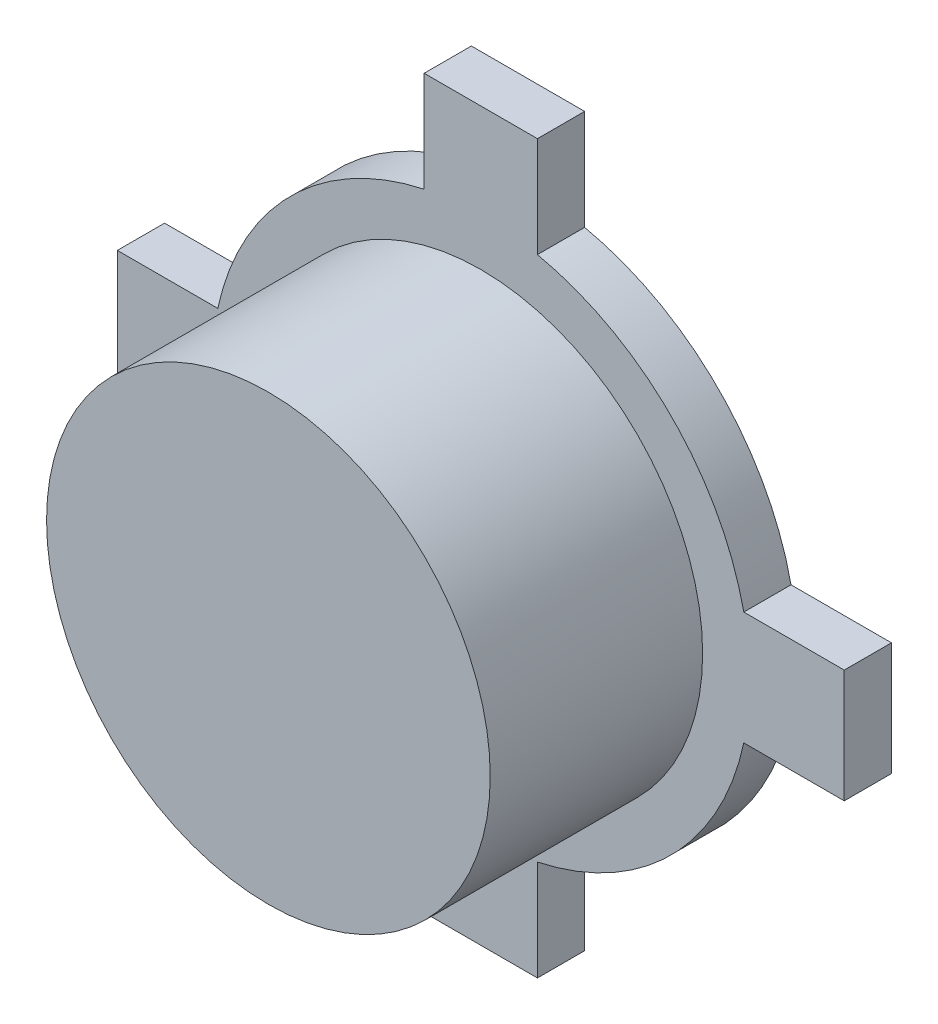
from build123d import *

# Parameters (mm, degrees)
SKETCH1_R           = 4.7
BOSS_EXTRUDE1_DEPTH = 4.5
BOSS_EXTRUDE2_DEPTH = 1


with BuildPart() as part:
    # Sketch1 → Boss-Extrude1 (new body)
    with BuildSketch(Plane.XY):
        Circle(SKETCH1_R)
    extrude(amount=BOSS_EXTRUDE1_DEPTH)

    # Sketch2 → Boss-Extrude2 (add)
    with BuildSketch(Plane(origin=(0, 0, 0), x_dir=(-1, 0, 0), z_dir=(0, 0, -1))):
        with BuildLine():
            Line((-5.572252686, 1.2), (-7.7, 1.2))
            Line((-7.7, 1.2), (-7.7, -1.2))
            Line((-7.7, -1.2), (-5.572252686, -1.2))
            ThreePointArc((-5.572252686, -1.2), (-4.030508653, -4.030508653), (-1.2, -5.572252686))
            Line((-1.2, -5.572252686), (-1.2, -7.7))
            Line((-1.2, -7.7), (1.2, -7.7))
            Line((1.2, -7.7), (1.2, -5.572252686))
            ThreePointArc((1.2, -5.572252686), (4.030508653, -4.030508653), (5.572252686, -1.2))
            Line((5.572252686, -1.2), (7.7, -1.2))
            Line((7.7, -1.2), (7.7, 1.2))
            Line((7.7, 1.2), (5.572252686, 1.2))
            ThreePointArc((5.572252686, 1.2), (4.030508653, 4.030508653), (1.2, 5.572252686))
            Line((1.2, 5.572252686), (1.2, 7.7))
            Line((1.2, 7.7), (-1.2, 7.7))
            Line((-1.2, 7.7), (-1.2, 5.572252686))
            ThreePointArc((-1.2, 5.572252686), (-4.030508653, 4.030508653), (-5.572252686, 1.2))
        make_face()
    extrude(amount=BOSS_EXTRUDE2_DEPTH)


solid = part.part
